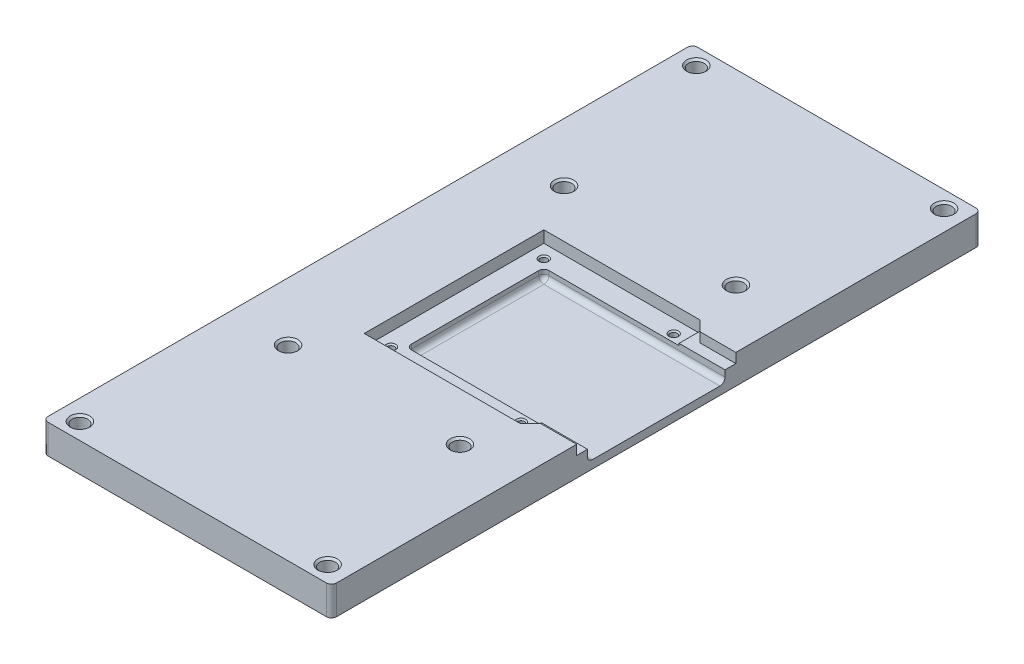
from build123d import *

# Parameters (mm, degrees)
BOSS_EXTRUDE1_DEPTH     = 11.5
SKETCH4_R               = 3.075
CUT_EXTRUDE1_DEPTH      = 6
CUT_EXTRUDE6_DEPTH      = 4.6
CUT_EXTRUDE3_DEPTH      = 140.679098741
CUT_EXTRUDE3_DEPTH_BACK = 3.7
SKETCH24_W              = 71.125
SKETCH24_H              = 54
SKETCH25_R              = 1.35
CUT_EXTRUDE4_DEPTH      = 5
CHAMFER4_SIZE           = 0.5
FILLET1_R               = 2
BOSS_EXTRUDE2_DEPTH     = 0.8
CHAMFER5_SIZE           = 0.75


with BuildPart() as part:
    # Sketch1 → Boss-Extrude1 (new body)
    with BuildSketch(Plane(origin=(0, 0, 0), x_dir=(1, 0, 0), z_dir=(0, 1, 0))):
        with BuildLine():
            Line((-56.625, 112.5), (-56.625, -112.5))
            Line((-56.625, -112.5), (-56.625, -125.5))
            ThreePointArc((-56.625, -125.5), (-56.039213562, -126.914213562), (-54.625, -127.5))
            Line((-54.625, -127.5), (54.625, -127.5))
            ThreePointArc((54.625, -127.5), (56.039213562, -126.914213562), (56.625, -125.5))
            Line((56.625, -125.5), (56.625, -112.5))
            Line((56.625, -112.5), (56.625, 112.5))
            Line((56.625, 112.5), (56.625, 125.5))
            ThreePointArc((56.625, 125.5), (56.039213562, 126.914213562), (54.625, 127.5))
            Line((54.625, 127.5), (-54.625, 127.5))
            ThreePointArc((-54.625, 127.5), (-56.039213562, 126.914213562), (-56.625, 125.5))
            Line((-56.625, 125.5), (-56.625, 112.5))
        make_face()
    extrude(amount=BOSS_EXTRUDE1_DEPTH)

    # Sketch4 → Cut-Extrude1 (cut)
    with BuildSketch(Plane(origin=(0, 11.5, 0), x_dir=(1, 0, 0), z_dir=(0, 1, 0))):
        with Locations(Location((-48.625, -121, 0), (0, 0, 270))):
            Circle(SKETCH4_R)
        with Locations(Location((48.625, -121, 0), (0, 0, 270))):
            Circle(SKETCH4_R)
        with Locations(Location((48.625, 121, 0), (0, 0, 270))):
            Circle(SKETCH4_R)
        with Locations(Location((-48.625, 121, 0), (0, 0, 270))):
            Circle(SKETCH4_R)
        with Locations(Location((-33.75, -54.175, 0), (0, 0, 270))):
            Circle(SKETCH4_R)
        with Locations(Location((33.75, -54.175, 0), (0, 0, 270))):
            Circle(SKETCH4_R)
        with Locations(Location((33.75, 54.175, 0), (0, 0, 270))):
            Circle(SKETCH4_R)
        with Locations(Location((-33.75, 54.175, 0), (0, 0, 270))):
            Circle(SKETCH4_R)
    extrude(amount=-CUT_EXTRUDE1_DEPTH, mode=Mode.SUBTRACT)

    # Sketch21 → Cut-Extrude6 (cut)
    with BuildSketch(Plane(origin=(0, 11.5, 0), x_dir=(1, 0, 0), z_dir=(0, 1, 0))):
        Polygon((56.625, 31), (56.625, -31), (56.625, -31.25), (42.603553391, -31.25), (38.603553391, -35.25), (-22.75, -35.25), (-22.75, 35.25), (38.603553391, 35.25), (42.603553391, 31.25), (56.625, 31.25), align=None)
    extrude(amount=-CUT_EXTRUDE6_DEPTH, mode=Mode.SUBTRACT)

    # Sketch24 → Cut-Extrude3 (cut, two sides: drawn at the far end of the back side and taken through both)
    with BuildSketch(Plane(origin=(0, 6.9, 0), x_dir=(1, 0, 0), z_dir=(0, 1, 0)).offset(-CUT_EXTRUDE3_DEPTH_BACK)):
        with Locations((21.0625, 0)):
            Rectangle(SKETCH24_W, SKETCH24_H)
    extrude(amount=CUT_EXTRUDE3_DEPTH + CUT_EXTRUDE3_DEPTH_BACK, mode=Mode.SUBTRACT)

    # Sketch25 → Cut-Extrude4 (cut)
    with BuildSketch(Plane(origin=(0, 6.9, 0), x_dir=(1, 0, 0), z_dir=(0, 1, 0))):
        with Locations(Location((33.5, 30, 0), (0, 0, 270))):
            Circle(SKETCH25_R)
        with Locations(Location((-17.5, 30, 0), (0, 0, 270))):
            Circle(SKETCH25_R)
        with Locations(Location((33.5, -30, 0), (0, 0, 270))):
            Circle(SKETCH25_R)
        with Locations(Location((-17.5, -30, 0), (0, 0, 270))):
            Circle(SKETCH25_R)
    extrude(amount=-CUT_EXTRUDE4_DEPTH, mode=Mode.SUBTRACT)

    # Chamfer4
    chamfer4_edges = [part.edges().sort_by_distance(p)[0] for p in [
        (-17.5, 6.9, -31.35),
        (33.5, 6.9, 28.65),
        (-17.5, 6.9, 28.65),
        (33.5, 6.9, -31.35),
    ]]
    chamfer(chamfer4_edges, length=CHAMFER4_SIZE)

    # Fillet1
    fillet1_edges = [part.edges().sort_by_distance(p)[0] for p in [
        (21.0625, 3.2, -27),
        (-14.5, 5.05, -27),
        (-14.5, 3.2, 0),
        (-14.5, 5.05, 27),
        (21.0625, 3.2, 27),
    ]]
    fillet(fillet1_edges, radius=FILLET1_R)

    # Sketch26 → Boss-Extrude2 (add)
    with BuildSketch(Plane(origin=(0, 6.9, 0), x_dir=(1, 0, 0), z_dir=(0, 1, 0))):
        Polygon((38.603553391, 35.25), (38.603553391, 27), (56.625, 27), (56.625, 31.25), (42.603553391, 31.25), align=None)
        Polygon((42.603553391, -31.25), (38.603553391, -35.25), (38.603553391, -27), (56.625, -27), (56.625, -31.25), align=None)
    extrude(amount=BOSS_EXTRUDE2_DEPTH)

    # Chamfer5
    chamfer5_edges = [part.edges().sort_by_distance(p)[0] for p in [
        (48.625, 11.5, 117.925),
        (48.625, 11.5, -124.075),
        (-33.75, 11.5, 51.1),
        (33.75, 11.5, 51.1),
        (-33.75, 11.5, -57.25),
        (33.75, 11.5, -57.25),
        (-48.625, 11.5, -124.075),
        (-48.625, 11.5, 117.925),
    ]]
    chamfer(chamfer5_edges, length=CHAMFER5_SIZE)


solid = part.part
